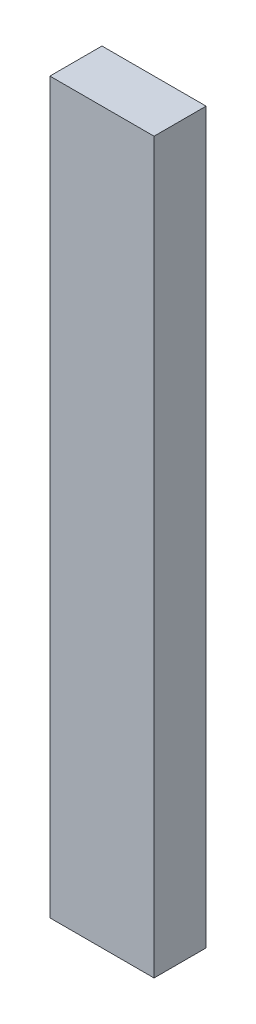
from build123d import *

# Parameters (mm, degrees)
SKETCH1_W           = 25.4
SKETCH1_H           = 12.7
BOSS_EXTRUDE1_DEPTH = 177.8


with BuildPart() as part:
    # Sketch1 → Boss-Extrude1 (new body)
    with BuildSketch(Plane(origin=(0, 0, 0), x_dir=(1, 0, 0), z_dir=(0, 1, 0))):
        Rectangle(SKETCH1_W, SKETCH1_H)
    extrude(amount=BOSS_EXTRUDE1_DEPTH)


solid = part.part
